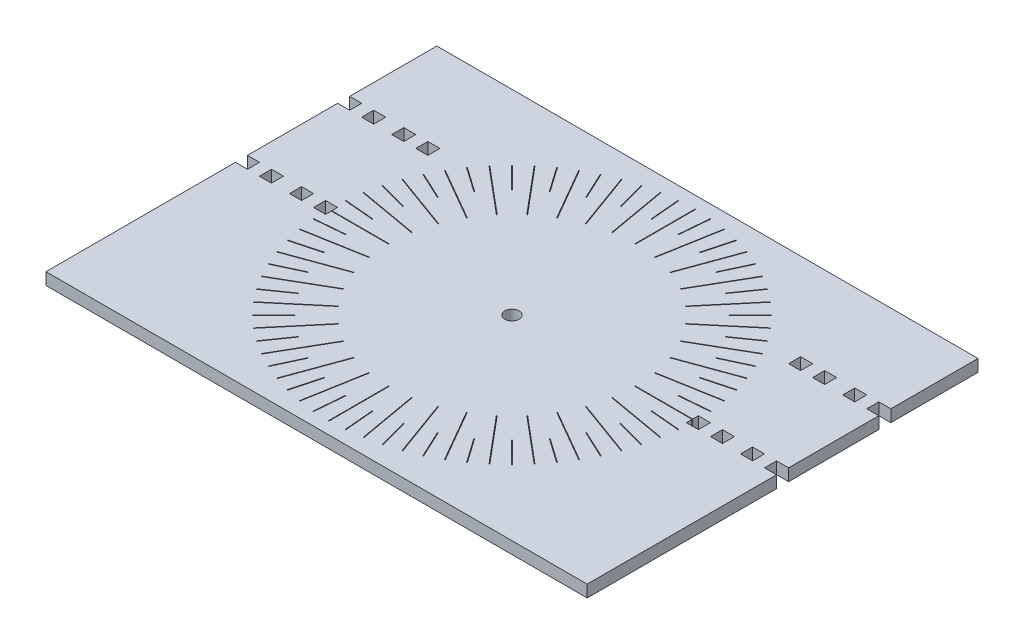
from build123d import *

# Parameters (mm, degrees)
SKETCH1_W           = 5.08
SKETCH1_H           = 5.08
SKETCH1_R           = 3.048
BOSS_EXTRUDE1_DEPTH = 5.08
SKETCH3_W           = 12.7
SKETCH3_H           = 0.254
SKETCH3_W_2         = 0.254
SKETCH3_H_2         = 12.7
CUT_EXTRUDE1_DEPTH  = 5.08
SKETCH4_W           = 25.4
SKETCH4_H           = 0.254
SKETCH4_W_2         = 0.254
SKETCH4_H_2         = 25.4
CUT_EXTRUDE2_DEPTH  = 5.08


with BuildPart() as part:
    # Sketch1 → Boss-Extrude1 (new body)
    with BuildSketch(Plane(origin=(0, 0, 0), x_dir=(1, 0, 0), z_dir=(0, 1, 0))):
        Polygon((127.672847682, 67.873509934), (-100.927152318, 67.873509934), (-100.927152318, 31.043509934), (-95.847152318, 31.043509934), (-95.847152318, 25.963509934), (-100.927152318, 25.963509934), (-100.927152318, -12.136490066), (-95.847152318, -12.136490066), (-95.847152318, -17.216490066), (-100.927152318, -17.216490066), (-100.927152318, -97.226490066), (127.672847682, -97.226490066), (127.672847682, -17.216490066), (122.592847682, -17.216490066), (122.592847682, -12.136490066), (127.672847682, -12.136490066), (127.672847682, 25.963509934), (122.592847682, 25.963509934), (122.592847682, 31.043509934), (127.672847682, 31.043509934), align=None)
        with Locations((-88.227152318, -14.676490066)):
            Rectangle(SKETCH1_W, SKETCH1_H, mode=Mode.SUBTRACT)
        with Locations((-75.527152318, -14.676490066)):
            Rectangle(SKETCH1_W, SKETCH1_H, mode=Mode.SUBTRACT)
        with Locations((-65.367152318, -14.676490066)):
            Rectangle(SKETCH1_W, SKETCH1_H, mode=Mode.SUBTRACT)
        with Locations((-88.227152318, 28.503509934)):
            Rectangle(SKETCH1_W, SKETCH1_H, mode=Mode.SUBTRACT)
        with Locations((-75.527152318, 28.503509934)):
            Rectangle(SKETCH1_W, SKETCH1_H, mode=Mode.SUBTRACT)
        with Locations((-65.367152318, 28.503509934)):
            Rectangle(SKETCH1_W, SKETCH1_H, mode=Mode.SUBTRACT)
        with Locations(Location((13.372847682, -14.676490066, 0), (0, 0, 270))):
            Circle(SKETCH1_R, mode=Mode.SUBTRACT)
        with Locations((92.112847682, -14.676490066)):
            Rectangle(SKETCH1_W, SKETCH1_H, mode=Mode.SUBTRACT)
        with Locations((102.272847682, -14.676490066)):
            Rectangle(SKETCH1_W, SKETCH1_H, mode=Mode.SUBTRACT)
        with Locations((114.972847682, -14.676490066)):
            Rectangle(SKETCH1_W, SKETCH1_H, mode=Mode.SUBTRACT)
        with Locations((92.112847682, 28.503509934)):
            Rectangle(SKETCH1_W, SKETCH1_H, mode=Mode.SUBTRACT)
        with Locations((102.272847682, 28.503509934)):
            Rectangle(SKETCH1_W, SKETCH1_H, mode=Mode.SUBTRACT)
        with Locations((114.972847682, 28.503509934)):
            Rectangle(SKETCH1_W, SKETCH1_H, mode=Mode.SUBTRACT)
    extrude(amount=BOSS_EXTRUDE1_DEPTH)

    # Sketch3 → Cut-Extrude1 (cut)
    with BuildSketch(Plane(origin=(0, 5.08, 0), x_dir=(1, 0, 0), z_dir=(0, 1, 0))):
        Polygon((77.907447057, -20.195050797), (90.559119723, -21.30192873), (90.536982164, -21.554962184), (77.885309498, -20.448084251), align=None)
        with Locations((84.492847682, -14.676490066)):
            Rectangle(SKETCH3_W, SKETCH3_H)
        Polygon((77.180899163, -25.798611949), (89.687957627, -28.003943805), (89.643850989, -28.254084975), (77.136792526, -26.048753118), align=None)
        Polygon((75.96873347, -31.317527038), (88.235991463, -34.60452891), (88.170251426, -34.84987407), (75.902993432, -31.562872197), align=None)
        Polygon((74.280175289, -36.709793787), (86.214271573, -41.053449607), (86.127398456, -41.292131533), (74.193302172, -36.948475712), align=None)
        Polygon((72.128075568, -41.93437379), (83.638184463, -47.301625714), (83.530839425, -47.531827892), (72.020730529, -42.164575968), align=None)
        Polygon((69.528813085, -46.95150484), (80.527335713, -53.30150484), (80.400335713, -53.521475293), (69.401813085, -47.171475293), align=None)
        Polygon((66.502169798, -51.723003539), (76.905400761, -59.007424281), (76.759712346, -59.2154889), (66.356481383, -51.931068158), align=None)
        Polygon((63.071180289, -56.212555901), (72.799944717, -64.375958544), (72.636676664, -64.570533833), (62.907912237, -56.40713119), align=None)
        Polygon((59.261956461, -60.385993722), (68.242212582, -69.366249844), (68.062607459, -69.545854966), (59.082351338, -60.565598845), align=None)
        Polygon((55.103488806, -64.211554621), (63.266891449, -73.940319048), (63.07231616, -74.103587101), (54.908913517, -64.374822673), align=None)
        Polygon((50.627425774, -67.660123767), (57.911846516, -78.06335473), (57.703781897, -78.209043145), (50.419361155, -67.805812182), align=None)
        Polygon((45.867832908, -70.705455469), (52.217832908, -81.703978097), (51.997862456, -81.830978097), (45.647862456, -70.832455469), align=None)
        Polygon((40.860933584, -73.324372913), (46.228185508, -84.834481809), (45.99798333, -84.941826847), (40.630731406, -73.431717952), align=None)
        Polygon((35.644833328, -75.496944556), (39.988489148, -87.43104084), (39.749807223, -87.517913957), (35.406151402, -75.583817673), align=None)
        Polygon((30.259229813, -77.206635816), (33.546231686, -89.47389381), (33.300886526, -89.539633848), (30.013884653, -77.272375854), align=None)
        Polygon((24.745110734, -78.44043491), (26.950442591, -90.947493374), (26.700301421, -90.991600011), (24.494969565, -78.484541547), align=None)
        Polygon((19.144441867, -79.188951882), (20.251319799, -91.840624548), (19.998286346, -91.862762107), (18.891408413, -79.211089441), align=None)
        with Locations((13.372847682, -85.796490066)):
            Rectangle(SKETCH3_W_2, SKETCH3_H_2)
        Polygon((7.854286951, -79.211089441), (6.747409018, -91.862762107), (6.494375565, -91.840624548), (7.601253498, -79.188951882), align=None)
        Polygon((2.250725799, -78.484541547), (0.045393943, -90.991600011), (-0.204747226, -90.947493374), (2.00058463, -78.44043491), align=None)
        Polygon((-3.268189289, -77.272375854), (-6.555191162, -89.539633848), (-6.800536322, -89.47389381), (-3.513534449, -77.206635816), align=None)
        Polygon((-8.660456038, -75.583817673), (-13.004111858, -87.517913957), (-13.242793784, -87.43104084), (-8.899137964, -75.496944556), align=None)
        Polygon((-13.885036042, -73.431717952), (-19.252287966, -84.941826847), (-19.482490144, -84.834481809), (-14.11523822, -73.324372913), align=None)
        Polygon((-18.902167092, -70.832455469), (-25.252167092, -81.830978097), (-25.472137544, -81.703978097), (-19.122137544, -70.705455469), align=None)
        Polygon((-23.673665791, -67.805812182), (-30.958086532, -78.209043145), (-31.166151152, -78.06335473), (-23.88173041, -67.660123767), align=None)
        Polygon((-28.163218153, -64.374822673), (-36.326620796, -74.103587101), (-36.521196085, -73.940319048), (-28.357793442, -64.211554621), align=None)
        Polygon((-32.336655974, -60.565598845), (-41.316912095, -69.545854966), (-41.496517218, -69.366249844), (-32.516261097, -60.385993722), align=None)
        Polygon((-36.162216872, -56.40713119), (-45.8909813, -64.570533833), (-46.054249353, -64.375958544), (-36.325484925, -56.212555901), align=None)
        Polygon((-39.610786019, -51.931068158), (-50.014016982, -59.2154889), (-50.159705396, -59.007424281), (-39.756474434, -51.723003539), align=None)
        Polygon((-42.656117721, -47.171475293), (-53.654640349, -53.521475293), (-53.781640349, -53.30150484), (-42.783117721, -46.95150484), align=None)
        Polygon((-45.275035165, -42.164575968), (-56.78514406, -47.531827892), (-56.892489099, -47.301625714), (-45.382380203, -41.93437379), align=None)
        Polygon((-47.447606808, -36.948475712), (-59.381703092, -41.292131533), (-59.468576208, -41.053449607), (-47.534479924, -36.709793787), align=None)
        Polygon((-49.157298068, -31.562872197), (-61.424556062, -34.84987407), (-61.490296099, -34.60452891), (-49.223038105, -31.317527038), align=None)
        Polygon((-50.391097162, -26.048753118), (-62.898155625, -28.254084975), (-62.942262262, -28.003943805), (-50.435203799, -25.798611949), align=None)
        Polygon((-51.139614134, -20.448084251), (-63.7912868, -21.554962184), (-63.813424358, -21.30192873), (-51.161751693, -20.195050797), align=None)
        with Locations((-57.747152318, -14.676490066)):
            Rectangle(SKETCH3_W, SKETCH3_H)
        Polygon((-51.161751693, -9.157929335), (-63.813424358, -8.051051402), (-63.7912868, -7.798017949), (-51.139614134, -8.904895882), align=None)
        Polygon((-50.435203799, -3.554368183), (-62.942262262, -1.349036327), (-62.898155625, -1.098895158), (-50.391097162, -3.304227014), align=None)
        Polygon((-49.223038105, 1.964546905), (-61.490296099, 5.251548778), (-61.424556062, 5.496893938), (-49.157298068, 2.209892065), align=None)
        Polygon((-47.534479924, 7.356813654), (-59.468576208, 11.700469474), (-59.381703092, 11.9391514), (-47.447606808, 7.59549558), align=None)
        Polygon((-45.382380203, 12.581393658), (-56.892489099, 17.948645582), (-56.78514406, 18.17884776), (-45.275035165, 12.811595836), align=None)
        Polygon((-42.783117721, 17.598524707), (-53.781640349, 23.948524707), (-53.654640349, 24.16849516), (-42.656117721, 17.81849516), align=None)
        Polygon((-39.756474434, 22.370023407), (-50.159705396, 29.654444148), (-50.014016982, 29.862508768), (-39.610786019, 22.578088026), align=None)
        Polygon((-36.325484925, 26.859575769), (-46.054249353, 35.022978412), (-45.8909813, 35.2175537), (-36.162216872, 27.054151057), align=None)
        Polygon((-32.516261097, 31.03301359), (-41.496517218, 40.013269711), (-41.316912095, 40.192874834), (-32.336655974, 31.212618712), align=None)
        Polygon((-28.357793442, 34.858574488), (-36.521196085, 44.587338916), (-36.326620796, 44.750606969), (-28.163218153, 35.021842541), align=None)
        Polygon((-23.88173041, 38.307143635), (-31.166151152, 48.710374597), (-30.958086532, 48.856063012), (-23.673665791, 38.45283205), align=None)
        Polygon((-19.122137544, 41.352475337), (-25.472137544, 52.350997965), (-25.252167092, 52.477997965), (-18.902167092, 41.479475337), align=None)
        Polygon((-14.11523822, 43.971392781), (-19.482490144, 55.481501676), (-19.252287966, 55.588846715), (-13.885036042, 44.078737819), align=None)
        Polygon((-8.899137964, 46.143964424), (-13.242793784, 58.078060708), (-13.004111858, 58.164933824), (-8.660456038, 46.23083754), align=None)
        Polygon((-3.513534449, 47.853655684), (-6.800536322, 60.120913678), (-6.555191162, 60.186653715), (-3.268189289, 47.919395721), align=None)
        Polygon((2.00058463, 49.087454778), (-0.204747226, 61.594513241), (0.045393943, 61.638619878), (2.250725799, 49.131561415), align=None)
        Polygon((7.601253498, 49.83597175), (6.494375565, 62.487644416), (6.747409018, 62.509781974), (7.854286951, 49.858109309), align=None)
        with Locations((13.372847682, 56.443509934)):
            Rectangle(SKETCH3_W_2, SKETCH3_H_2)
        Polygon((18.891408413, 49.858109309), (19.998286346, 62.509781974), (20.251319799, 62.487644416), (19.144441867, 49.83597175), align=None)
        Polygon((24.494969565, 49.131561415), (26.700301421, 61.638619878), (26.950442591, 61.594513241), (24.745110734, 49.087454778), align=None)
        Polygon((30.013884653, 47.919395721), (33.300886526, 60.186653715), (33.546231686, 60.120913678), (30.259229813, 47.853655684), align=None)
        Polygon((35.406151402, 46.23083754), (39.749807223, 58.164933824), (39.988489148, 58.078060708), (35.644833328, 46.143964424), align=None)
        Polygon((40.630731406, 44.078737819), (45.99798333, 55.588846715), (46.228185508, 55.481501676), (40.860933584, 43.971392781), align=None)
        Polygon((45.647862456, 41.479475337), (51.997862456, 52.477997965), (52.217832908, 52.350997965), (45.867832908, 41.352475337), align=None)
        Polygon((50.419361155, 38.45283205), (57.703781897, 48.856063012), (57.911846516, 48.710374597), (50.627425774, 38.307143635), align=None)
        Polygon((54.908913517, 35.021842541), (63.07231616, 44.750606969), (63.266891449, 44.587338916), (55.103488806, 34.858574488), align=None)
        Polygon((59.082351338, 31.212618712), (68.062607459, 40.192874834), (68.242212582, 40.013269711), (59.261956461, 31.03301359), align=None)
        Polygon((62.907912237, 27.054151057), (72.636676664, 35.2175537), (72.799944717, 35.022978412), (63.071180289, 26.859575769), align=None)
        Polygon((66.356481383, 22.578088026), (76.759712346, 29.862508768), (76.905400761, 29.654444148), (66.502169798, 22.370023407), align=None)
        Polygon((69.401813085, 17.81849516), (80.400335713, 24.16849516), (80.527335713, 23.948524707), (69.528813085, 17.598524707), align=None)
        Polygon((72.020730529, 12.811595836), (83.530839425, 18.17884776), (83.638184463, 17.948645582), (72.128075568, 12.581393658), align=None)
        Polygon((74.193302172, 7.59549558), (86.127398456, 11.9391514), (86.214271573, 11.700469474), (74.280175289, 7.356813654), align=None)
        Polygon((75.902993432, 2.209892065), (88.170251426, 5.496893938), (88.235991463, 5.251548778), (75.96873347, 1.964546905), align=None)
        Polygon((77.136792526, -3.304227014), (89.643850989, -1.098895158), (89.687957627, -1.349036327), (77.180899163, -3.554368183), align=None)
        Polygon((77.885309498, -8.904895882), (90.536982164, -7.798017949), (90.559119723, -8.051051402), (77.907447057, -9.157929335), align=None)
    extrude(amount=-CUT_EXTRUDE1_DEPTH, mode=Mode.SUBTRACT)

    # Sketch4 → Cut-Extrude2 (cut)
    with BuildSketch(Plane(origin=(0, 5.08, 0), x_dir=(1, 0, 0), z_dir=(0, 1, 0))):
        Polygon((64.6738407, -23.593280093), (89.687957627, -28.003943805), (89.643850989, -28.254084975), (64.629734063, -23.843421262), align=None)
        with Locations((78.142847682, -14.676490066)):
            Rectangle(SKETCH4_W, SKETCH4_H)
        Polygon((62.346079005, -32.366137966), (86.214271573, -41.053449607), (86.127398456, -41.292131533), (62.259205888, -32.604819892), align=None)
        Polygon((58.530290457, -40.60150484), (80.527335713, -53.30150484), (80.400335713, -53.521475293), (58.403290457, -40.821475293), align=None)
        Polygon((53.342415862, -48.049153258), (72.799944717, -64.375958544), (72.636676664, -64.570533833), (53.179147809, -48.243728547), align=None)
        Polygon((46.940086163, -54.482790193), (63.266891449, -73.940319048), (63.07231616, -74.103587101), (46.745510874, -54.646058246), align=None)
        Polygon((39.517832908, -59.706932841), (52.217832908, -81.703978097), (51.997862456, -81.830978097), (39.297862456, -59.833932841), align=None)
        Polygon((31.301177508, -63.562848272), (39.988489148, -87.43104084), (39.749807223, -87.517913957), (31.062495582, -63.649721389), align=None)
        Polygon((22.539778878, -65.933376447), (26.950442591, -90.947493374), (26.700301421, -90.991600011), (22.289637709, -65.977483084), align=None)
        with Locations((13.372847682, -79.446490066)):
            Rectangle(SKETCH4_W_2, SKETCH4_H_2)
        Polygon((4.456057656, -65.977483084), (0.045393943, -90.991600011), (-0.204747226, -90.947493374), (4.205916486, -65.933376447), align=None)
        Polygon((-4.316800218, -63.649721389), (-13.004111858, -87.517913957), (-13.242793784, -87.43104084), (-4.555482144, -63.562848272), align=None)
        Polygon((-12.552167092, -59.833932841), (-25.252167092, -81.830978097), (-25.472137544, -81.703978097), (-12.772137544, -59.706932841), align=None)
        Polygon((-19.99981551, -54.646058246), (-36.326620796, -74.103587101), (-36.521196085, -73.940319048), (-20.194390799, -54.482790193), align=None)
        Polygon((-26.433452445, -48.243728547), (-45.8909813, -64.570533833), (-46.054249353, -64.375958544), (-26.596720498, -48.049153258), align=None)
        Polygon((-31.657595093, -40.821475293), (-53.654640349, -53.521475293), (-53.781640349, -53.30150484), (-31.784595093, -40.60150484), align=None)
        Polygon((-35.513510524, -32.604819892), (-59.381703092, -41.292131533), (-59.468576208, -41.053449607), (-35.60038364, -32.366137966), align=None)
        Polygon((-37.884038699, -23.843421262), (-62.898155625, -28.254084975), (-62.942262262, -28.003943805), (-37.928145336, -23.593280093), align=None)
        with Locations((-51.397152318, -14.676490066)):
            Rectangle(SKETCH4_W, SKETCH4_H)
        Polygon((-37.928145336, -5.75970004), (-62.942262262, -1.349036327), (-62.898155625, -1.098895158), (-37.884038699, -5.50955887), align=None)
        Polygon((-35.60038364, 3.013157834), (-59.468576208, 11.700469474), (-59.381703092, 11.9391514), (-35.513510524, 3.25183976), align=None)
        Polygon((-31.784595093, 11.248524707), (-53.781640349, 23.948524707), (-53.654640349, 24.16849516), (-31.657595093, 11.46849516), align=None)
        Polygon((-26.596720498, 18.696173126), (-46.054249353, 35.022978412), (-45.8909813, 35.2175537), (-26.433452445, 18.890748414), align=None)
        Polygon((-20.194390799, 25.129810061), (-36.521196085, 44.587338916), (-36.326620796, 44.750606969), (-19.99981551, 25.293078113), align=None)
        Polygon((-12.772137544, 30.353952709), (-25.472137544, 52.350997965), (-25.252167092, 52.477997965), (-12.552167092, 30.480952709), align=None)
        Polygon((-4.555482144, 34.20986814), (-13.242793784, 58.078060708), (-13.004111858, 58.164933824), (-4.316800218, 34.296741256), align=None)
        Polygon((4.205916486, 36.580396315), (-0.204747226, 61.594513241), (0.045393943, 61.638619878), (4.456057656, 36.624502952), align=None)
        with Locations((13.372847682, 50.093509934)):
            Rectangle(SKETCH4_W_2, SKETCH4_H_2)
        Polygon((22.289637709, 36.624502952), (26.700301421, 61.638619878), (26.950442591, 61.594513241), (22.539778878, 36.580396315), align=None)
        Polygon((31.062495582, 34.296741256), (39.749807223, 58.164933824), (39.988489148, 58.078060708), (31.301177508, 34.20986814), align=None)
        Polygon((39.297862456, 30.480952709), (51.997862456, 52.477997965), (52.217832908, 52.350997965), (39.517832908, 30.353952709), align=None)
        Polygon((46.745510874, 25.293078113), (63.07231616, 44.750606969), (63.266891449, 44.587338916), (46.940086163, 25.129810061), align=None)
        Polygon((53.179147809, 18.890748414), (72.636676664, 35.2175537), (72.799944717, 35.022978412), (53.342415862, 18.696173126), align=None)
        Polygon((58.403290457, 11.46849516), (80.400335713, 24.16849516), (80.527335713, 23.948524707), (58.530290457, 11.248524707), align=None)
        Polygon((62.259205888, 3.25183976), (86.127398456, 11.9391514), (86.214271573, 11.700469474), (62.346079005, 3.013157834), align=None)
        Polygon((64.629734063, -5.50955887), (89.643850989, -1.098895158), (89.687957627, -1.349036327), (64.6738407, -5.75970004), align=None)
    extrude(amount=-CUT_EXTRUDE2_DEPTH, mode=Mode.SUBTRACT)


solid = part.part
